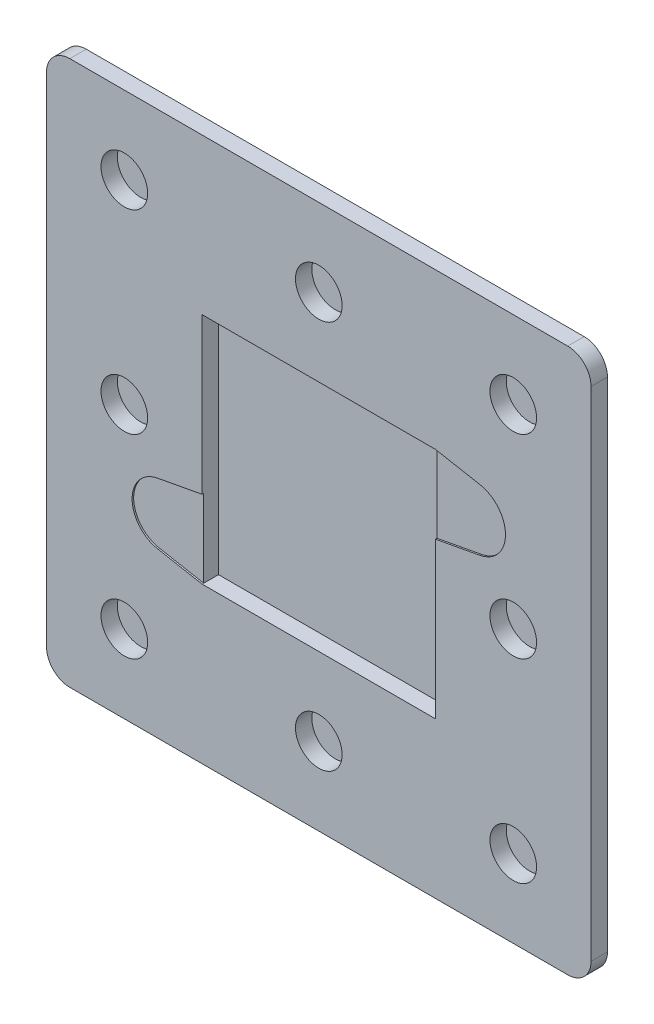
from build123d import *

# Parameters (mm, degrees)
SKETCH3_W           = 70
SKETCH3_H           = 70
BOSS_EXTRUDE1_DEPTH = 2.11
SKETCH6_R           = 3
SKETCH6_W           = 30
SKETCH6_H           = 30
CUT_EXTRUDE5_DEPTH  = 2.105
CUT_EXTRUDE7_DEPTH  = 0.2
FILLET1_R           = 3


with BuildPart() as part:
    # Sketch3 → Boss-Extrude1 (new body)
    with BuildSketch(Plane.XY):
        Rectangle(SKETCH3_W, SKETCH3_H)
    extrude(amount=BOSS_EXTRUDE1_DEPTH)

    # Sketch6 → Cut-Extrude5 (cut)
    with BuildSketch(Plane.XY.offset(2.11)):
        with Locations((0, 25)):
            Circle(SKETCH6_R)
        with Locations((25, 25)):
            Circle(SKETCH6_R)
        with Locations((25, 0)):
            Circle(SKETCH6_R)
        with Locations((25, -25)):
            Circle(SKETCH6_R)
        with Locations((0, -25)):
            Circle(SKETCH6_R)
        with Locations((-25, -25)):
            Circle(SKETCH6_R)
        with Locations((-25, 0)):
            Circle(SKETCH6_R)
        with Locations((-25, 25)):
            Circle(SKETCH6_R)
        Rectangle(SKETCH6_W, SKETCH6_H)
    extrude(amount=-CUT_EXTRUDE5_DEPTH, mode=Mode.SUBTRACT)

    # Sketch8 → Cut-Extrude7 (cut)
    with BuildSketch(Plane.XY.offset(2.11)):
        with BuildLine():
            Line((15, 5), (15, 15))
            Line((15, 15), (20.732380758, 13.932380758))
            ThreePointArc((20.732380758, 13.932380758), (24, 10), (20.732380758, 6.067619242))
            Line((20.732380758, 6.067619242), (15, 5))
        make_face()
        with BuildLine():
            Line((-15, -15), (-20.732380758, -13.932380758))
            ThreePointArc((-20.732380758, -13.932380758), (-24, -10), (-20.732380758, -6.067619242))
            Line((-20.732380758, -6.067619242), (-15, -5))
            Line((-15, -5), (-15, -15))
        make_face()
    extrude(amount=-CUT_EXTRUDE7_DEPTH, mode=Mode.SUBTRACT)

    # Fillet1
    fillet1_edges = [part.edges().sort_by_distance(p)[0] for p in [
        (35, -35, 1.055),
        (-35, -35, 1.055),
        (-35, 35, 1.055),
        (35, 35, 1.055),
    ]]
    fillet(fillet1_edges, radius=FILLET1_R)


solid = part.part
